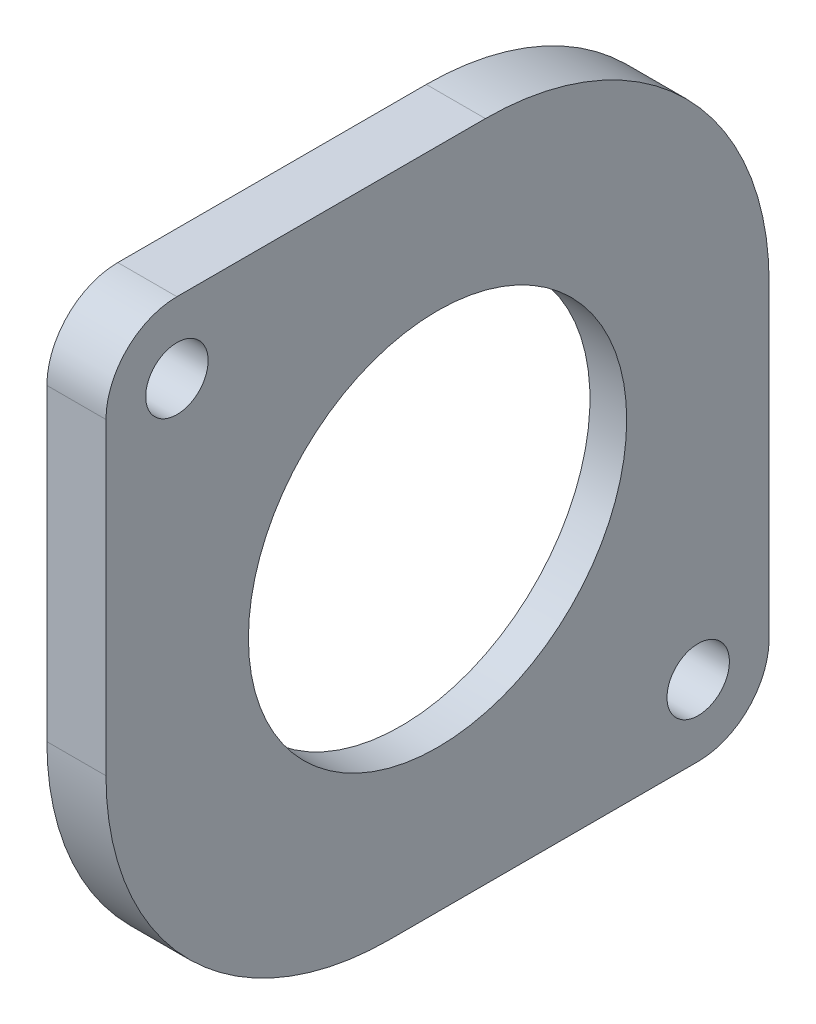
from build123d import *

# Parameters (mm, degrees)
SKETCH1_R             = 12.7
BOSS_EXTRUDE1_DEPTH   = 3.96875
SKETCH2_R             = 19.99742
CUT_EXTRUDE1_DEPTH    = 1.50114
F_8_CLEARANCE_HOLE1_D = 4.191
FILLET1_R             = 0.396875


with BuildPart() as part:
    # Sketch1 → Boss-Extrude1 (new body)
    with BuildSketch(Plane(origin=(0, 0, 0), x_dir=(0, 0, -1), z_dir=(1, 0, 0))):
        with BuildLine():
            Line((-17.5, 22.2625), (3.2125, 22.2625))
            ThreePointArc((3.2125, 22.2625), (16.682884182, 16.682884182), (22.2625, 3.2125))
            Line((22.2625, 3.2125), (22.2625, -17.5))
            ThreePointArc((22.2625, -17.5), (20.867596045, -20.867596045), (17.5, -22.2625))
            Line((17.5, -22.2625), (-3.2125, -22.2625))
            ThreePointArc((-3.2125, -22.2625), (-16.682884182, -16.682884182), (-22.2625, -3.2125))
            Line((-22.2625, -3.2125), (-22.2625, 17.5))
            ThreePointArc((-22.2625, 17.5), (-20.867596045, 20.867596045), (-17.5, 22.2625))
        make_face()
        Circle(SKETCH1_R, mode=Mode.SUBTRACT)
    extrude(amount=BOSS_EXTRUDE1_DEPTH)

    # Sketch2 → Cut-Extrude1 (cut)
    with BuildSketch(Plane.ZY):
        Circle(SKETCH2_R)
    extrude(amount=-CUT_EXTRUDE1_DEPTH, mode=Mode.SUBTRACT)

    # #8 Clearance Hole1 (through all)
    with Locations(Plane(origin=(3.96875, 0, 0), x_dir=(0, 0, -1), z_dir=(1, 0, 0))):
        with Locations((-17.5, 17.5), (17.5, -17.5)):
            Hole(F_8_CLEARANCE_HOLE1_D / 2)

    # Fillet1
    fillet1_edges = [part.edges().sort_by_distance(p)[0] for p in [
        (0, 0, -19.99742),
    ]]
    fillet(fillet1_edges, radius=FILLET1_R)


solid = part.part
